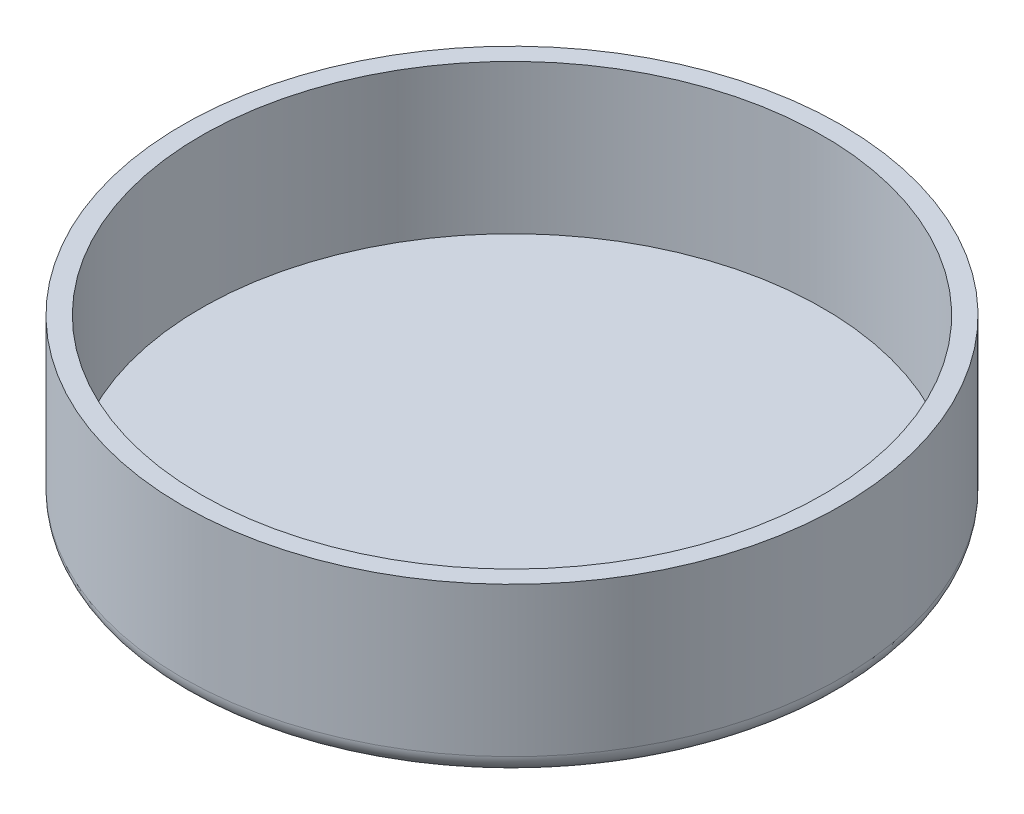
from build123d import *

# Parameters (mm, degrees)
SKETCH1_R           = 53
SKETCH1_R_2         = 50
BOSS_EXTRUDE1_DEPTH = 27
SKETCH1_2_R         = 53
BOSS_EXTRUDE2_DEPTH = 3
FILLET1_R           = 3


with BuildPart() as part:
    # Sketch1 → Boss-Extrude1 (new body)
    with BuildSketch(Plane(origin=(0, 0, 0), x_dir=(1, 0, 0), z_dir=(0, 1, 0))):
        Circle(SKETCH1_R)
        Circle(SKETCH1_R_2, mode=Mode.SUBTRACT)
    extrude(amount=BOSS_EXTRUDE1_DEPTH)

    # Sketch1<2> → Boss-Extrude2 (add)
    with BuildSketch(Plane(origin=(0, 0, 0), x_dir=(1, 0, 0), z_dir=(0, 1, 0))):
        Circle(SKETCH1_2_R)
    extrude(amount=BOSS_EXTRUDE2_DEPTH)

    # Fillet1
    fillet1_edges = [part.edges().sort_by_distance(p)[0] for p in [
        (-53, 0, 0),
    ]]
    fillet(fillet1_edges, radius=FILLET1_R)


solid = part.part
